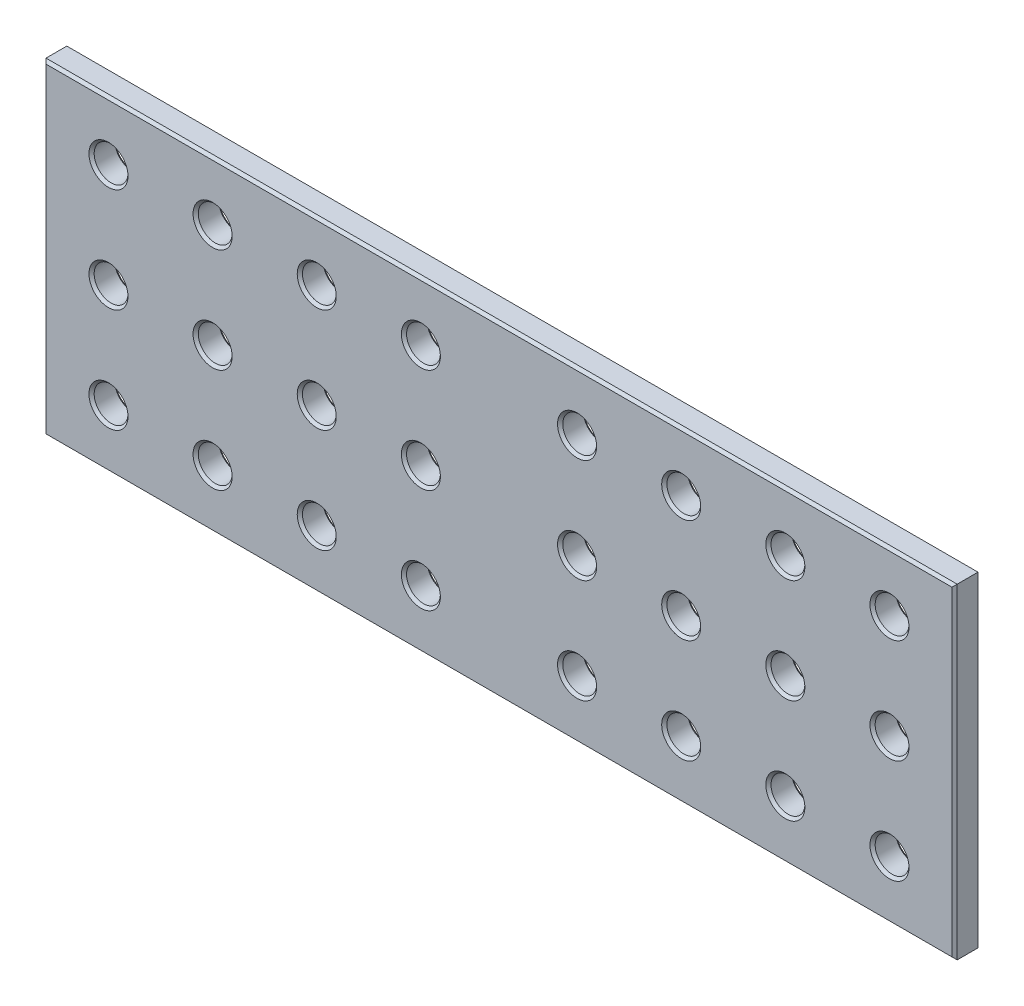
from build123d import *

# Parameters (mm, degrees)
SKETCH_1_W        = 700
SKETCH_1_H        = 250
SKETCH_1_R        = 13
EXTRUDE_621_DEPTH = 20
CHAMFER_1_SIZE    = 2


with BuildPart() as part:
    # 草图1 → Extrude 621 (new body)
    with BuildSketch(Plane.XY):
        Rectangle(SKETCH_1_W, SKETCH_1_H)
        with Locations((-300, 80)):
            Circle(SKETCH_1_R, mode=Mode.SUBTRACT)
        with Locations((-220, 80)):
            Circle(SKETCH_1_R, mode=Mode.SUBTRACT)
        with Locations((-140, 80)):
            Circle(SKETCH_1_R, mode=Mode.SUBTRACT)
        with Locations((-60, 80)):
            Circle(SKETCH_1_R, mode=Mode.SUBTRACT)
        with Locations((-60, 0)):
            Circle(SKETCH_1_R, mode=Mode.SUBTRACT)
        with Locations((-220, 0)):
            Circle(SKETCH_1_R, mode=Mode.SUBTRACT)
        with Locations((-300, 0)):
            Circle(SKETCH_1_R, mode=Mode.SUBTRACT)
        with Locations((-140, 0)):
            Circle(SKETCH_1_R, mode=Mode.SUBTRACT)
        with Locations(Location((-60, -80, 0), (0, 0, 180))):
            Circle(SKETCH_1_R, mode=Mode.SUBTRACT)
        with Locations(Location((-140, -80, 0), (0, 0, 180))):
            Circle(SKETCH_1_R, mode=Mode.SUBTRACT)
        with Locations(Location((-220, -80, 0), (0, 0, 180))):
            Circle(SKETCH_1_R, mode=Mode.SUBTRACT)
        with Locations(Location((-300, -80, 0), (0, 0, 180))):
            Circle(SKETCH_1_R, mode=Mode.SUBTRACT)
        with Locations((300, -80)):
            Circle(SKETCH_1_R, mode=Mode.SUBTRACT)
        with Locations((220, -80)):
            Circle(SKETCH_1_R, mode=Mode.SUBTRACT)
        with Locations((140, -80)):
            Circle(SKETCH_1_R, mode=Mode.SUBTRACT)
        with Locations((60, -80)):
            Circle(SKETCH_1_R, mode=Mode.SUBTRACT)
        with Locations(Location((140, 0, 0), (0, 0, 180))):
            Circle(SKETCH_1_R, mode=Mode.SUBTRACT)
        with Locations(Location((300, 0, 0), (0, 0, 180))):
            Circle(SKETCH_1_R, mode=Mode.SUBTRACT)
        with Locations(Location((220, 0, 0), (0, 0, 180))):
            Circle(SKETCH_1_R, mode=Mode.SUBTRACT)
        with Locations(Location((60, 0, 0), (0, 0, 180))):
            Circle(SKETCH_1_R, mode=Mode.SUBTRACT)
        with Locations(Location((60, 80, 0), (0, 0, 180))):
            Circle(SKETCH_1_R, mode=Mode.SUBTRACT)
        with Locations(Location((140, 80, 0), (0, 0, 180))):
            Circle(SKETCH_1_R, mode=Mode.SUBTRACT)
        with Locations(Location((220, 80, 0), (0, 0, 180))):
            Circle(SKETCH_1_R, mode=Mode.SUBTRACT)
        with Locations(Location((300, 80, 0), (0, 0, 180))):
            Circle(SKETCH_1_R, mode=Mode.SUBTRACT)
    extrude(amount=EXTRUDE_621_DEPTH)

    # 倒角1
    chamfer_1_edges = [part.edges().sort_by_distance(p)[0] for p in [
        (350, 0, 20),
        (-313, 80, 0),
        (-313, 80, 20),
        (0, 125, 20),
        (-233, 80, 0),
        (-233, 80, 20),
        (-153, 80, 0),
        (-153, 80, 20),
        (-73, 80, 0),
        (-73, 80, 20),
        (-73, 0, 0),
        (-73, 0, 20),
        (-233, 0, 0),
        (-233, 0, 20),
        (-313, 0, 0),
        (-313, 0, 20),
        (-153, 0, 0),
        (-153, 0, 20),
        (-350, 0, 20),
        (-47, -80, 0),
        (-47, -80, 20),
        (0, 125, 0),
        (-127, -80, 0),
        (-127, -80, 20),
        (350, 0, 0),
        (-207, -80, 0),
        (-207, -80, 20),
        (0, -125, 0),
        (-287, -80, 0),
        (-287, -80, 20),
        (-350, 0, 0),
        (287, -80, 0),
        (287, -80, 20),
        (207, -80, 0),
        (207, -80, 20),
        (127, -80, 0),
        (127, -80, 20),
        (47, -80, 0),
        (47, -80, 20),
        (0, -125, 20),
        (153, 0, 0),
        (153, 0, 20),
        (313, 0, 0),
        (313, 0, 20),
        (233, 0, 0),
        (233, 0, 20),
        (73, 0, 0),
        (73, 0, 20),
        (73, 80, 0),
        (73, 80, 20),
        (153, 80, 0),
        (153, 80, 20),
        (233, 80, 0),
        (233, 80, 20),
        (313, 80, 0),
        (313, 80, 20),
    ]]
    chamfer(chamfer_1_edges, length=CHAMFER_1_SIZE)


solid = part.part
